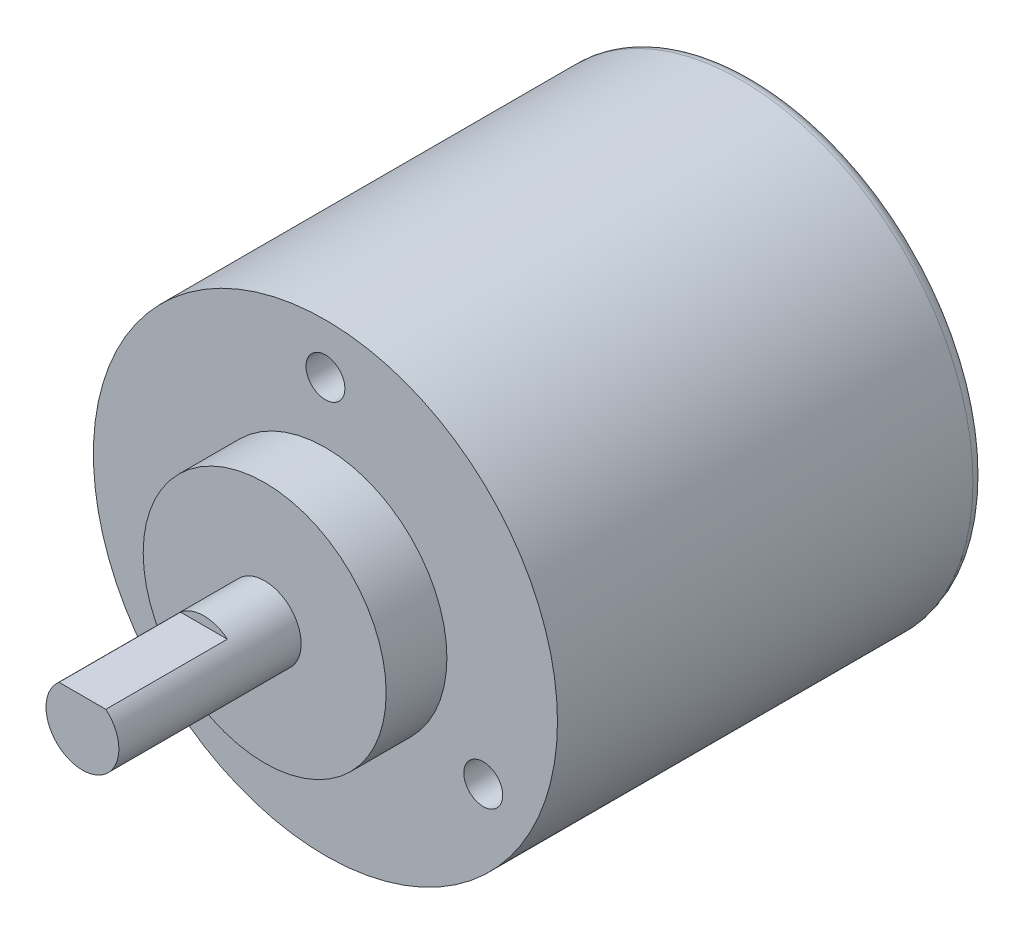
from build123d import *

# Parameters (mm, degrees)
SKETCH_1_R          = 19.1
EXTRUDE_1_DEPTH     = 35.2
SKETCH_2_R          = 10
EXTRUDE_2_DEPTH     = 5
SKETCH_4_R          = 1.6
CUT_EXTRUDE_1_DEPTH = 5
SKETCH_5_R          = 3
EXTRUDE_3_DEPTH     = 15
CUT_EXTRUDE_START   = -10
CUT_EXTRUDE_2_DEPTH = 10
FILLET_1_R          = 1


with BuildPart() as part:
    # 草图1 → 凸台-拉伸1 (new body)
    with BuildSketch(Plane.XY):
        Circle(SKETCH_1_R)
    extrude(amount=EXTRUDE_1_DEPTH)

    # 草图2 → 凸台-拉伸2 (add)
    with BuildSketch(Plane.XY.offset(35.2)):
        Circle(SKETCH_2_R)
    extrude(amount=EXTRUDE_2_DEPTH)

    # 草图4 → 切除-拉伸1 (cut)
    with BuildSketch(Plane.XY.offset(35.2)):
        with Locations((0, 15)):
            Circle(SKETCH_4_R)
        with Locations((12.990381057, -7.5)):
            Circle(SKETCH_4_R)
        with Locations((-12.990381057, -7.5)):
            Circle(SKETCH_4_R)
    extrude(amount=-CUT_EXTRUDE_1_DEPTH, mode=Mode.SUBTRACT)

    # 草图5 → 凸台-拉伸3 (add)
    with BuildSketch(Plane.XY.offset(40.2)):
        Circle(SKETCH_5_R)
    extrude(amount=EXTRUDE_3_DEPTH)

    # 草图6 → 切除-拉伸2 (cut)
    with BuildSketch(Plane.XY.offset(55.2).offset(CUT_EXTRUDE_START)):
        with BuildLine():
            Line((-1.926136028, 2.3), (1.926136028, 2.3))
            ThreePointArc((1.926136028, 2.3), (0, 3), (-1.926136028, 2.3))
        make_face()
    extrude(amount=CUT_EXTRUDE_2_DEPTH, mode=Mode.SUBTRACT)

    # 圆角1
    fillet_1_edges = [part.edges().sort_by_distance(p)[0] for p in [
        (-19.1, 0, 0),
    ]]
    fillet(fillet_1_edges, radius=FILLET_1_R)


solid = part.part
